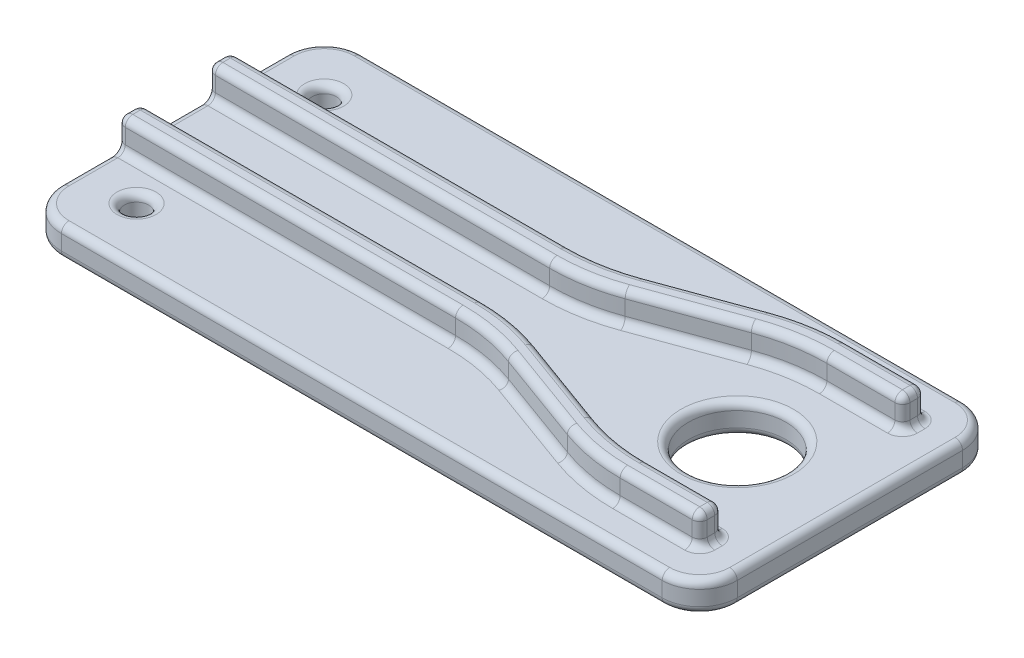
from build123d import *

# Parameters (mm, degrees)
SKETCH1_W           = 90
SKETCH1_H           = 40
SKETCH1_R           = 6.5
SKETCH1_R_2         = 1.6
BOSS_EXTRUDE1_DEPTH = 4
FILLET1_R           = 5
FILLET2_R           = 5
BOSS_EXTRUDE2_DEPTH = 4
FILLET3_R           = 25
FILLET4_R           = 1
FILLET5_R           = 1
FILLET6_R           = 1
FILLET7_R           = 1
FILLET8_R           = 1
FILLET9_R           = 1


with BuildPart() as part:
    # Sketch1 → Boss-Extrude1 (new body)
    with BuildSketch(Plane(origin=(0, 0, 0), x_dir=(1, 0, 0), z_dir=(0, 1, 0))):
        with Locations((45, 20)):
            Rectangle(SKETCH1_W, SKETCH1_H)
        with Locations(Location((75, 20, 0), (0, 0, 270))):
            Circle(SKETCH1_R, mode=Mode.SUBTRACT)
        with Locations(Location((7.5, 32.5, 0), (0, 0, 270))):
            Circle(SKETCH1_R_2, mode=Mode.SUBTRACT)
        with Locations(Location((7.5, 7.5, 0), (0, 0, 270))):
            Circle(SKETCH1_R_2, mode=Mode.SUBTRACT)
    extrude(amount=BOSS_EXTRUDE1_DEPTH)

    # Fillet1
    fillet1_edges = [part.edges().sort_by_distance(p)[0] for p in [
        (0, 2, -40),
        (0, 2, 0),
    ]]
    fillet(fillet1_edges, radius=FILLET1_R)

    # Fillet2
    fillet2_edges = [part.edges().sort_by_distance(p)[0] for p in [
        (90, 2, -40),
        (90, 2, 0),
    ]]
    fillet(fillet2_edges, radius=FILLET2_R)

    # Sketch2 → Boss-Extrude2 (add)
    with BuildSketch(Plane(origin=(0, 4, 0), x_dir=(1, 0, 0), z_dir=(0, 1, 0))):
        Polygon((0, 27.5), (0, 24.5), (49.922900296, 24.5), (70.528980942, 32), (85, 32), (85, 35), (70, 35), (49.393919354, 27.5), align=None)
        Polygon((0, 15.5), (49.922900296, 15.5), (70.528980942, 8), (85, 8), (85, 5), (70, 5), (49.393919354, 12.5), (0, 12.5), align=None)
    extrude(amount=BOSS_EXTRUDE2_DEPTH)

    # Fillet3
    fillet3_edges = [part.edges().sort_by_distance(p)[0] for p in [
        (49.393919354, 6, -27.5),
        (49.922900296, 6, -24.5),
        (70.528980942, 6, -32),
        (70, 6, -35),
        (49.393919354, 6, -12.5),
        (70, 6, -5),
        (70.528980942, 6, -8),
        (49.922900296, 6, -15.5),
    ]]
    fillet(fillet3_edges, radius=FILLET3_R)

    # Fillet4
    fillet4_edges = [part.edges().sort_by_distance(p)[0] for p in [
        (85, 6, -32),
        (85, 6, -35),
        (85, 6, -5),
        (85, 6, -8),
    ]]
    fillet(fillet4_edges, radius=FILLET4_R)

    # Fillet5
    fillet5_edges = [part.edges().sort_by_distance(p)[0] for p in [
        (22.757362889, 4, -15.5),
        (79.204087259, 4, -5),
        (59.696959677, 4, -8.75),
        (49.326949278, 4, -12.120193825),
        (70.595951018, 4, -31.620193825),
        (49.326949278, 4, -27.879806175),
        (70.595951018, 4, -8.379806175),
        (70.066970076, 4, -34.620193825),
        (49.85593022, 4, -15.120193825),
        (49.85593022, 4, -24.879806175),
        (70.066970076, 4, -5.379806175),
        (79.46857773, 4, -8),
        (85, 4, -6.5),
        (79.204087259, 4, -35),
        (85, 4, -33.5),
        (84.707106781, 4, -7.707106781),
        (84.707106781, 4, -5.292893219),
        (84.707106781, 4, -34.707106781),
        (84.707106781, 4, -32.292893219),
        (22.757362889, 4, -24.5),
        (22.492872418, 4, -12.5),
        (60.225940619, 4, -11.75),
        (22.492872418, 4, -27.5),
        (59.696959677, 4, -31.25),
        (79.46857773, 4, -32),
        (60.225940619, 4, -28.25),
    ]]
    fillet(fillet5_edges, radius=FILLET5_R)

    # Fillet6
    fillet6_edges = [part.edges().sort_by_distance(p)[0] for p in [
        (59.696959677, 8, -31.25),
        (22.492872418, 8, -27.5),
        (60.225940619, 8, -28.25),
        (79.46857773, 8, -32),
        (49.85593022, 8, -24.879806175),
        (70.066970076, 8, -34.620193825),
        (22.757362889, 8, -15.5),
        (59.696959677, 8, -8.75),
        (79.204087259, 8, -5),
        (70.066970076, 8, -5.379806175),
        (49.85593022, 8, -15.120193825),
        (70.595951018, 8, -8.379806175),
        (49.326949278, 8, -27.879806175),
        (70.595951018, 8, -31.620193825),
        (49.326949278, 8, -12.120193825),
        (79.46857773, 8, -8),
        (85, 8, -6.5),
        (84.707106781, 8, -5.292893219),
        (84.707106781, 8, -7.707106781),
        (79.204087259, 8, -35),
        (85, 8, -33.5),
        (84.707106781, 8, -32.292893219),
        (84.707106781, 8, -34.707106781),
        (22.757362889, 8, -24.5),
        (22.492872418, 8, -12.5),
        (60.225940619, 8, -11.75),
    ]]
    fillet(fillet6_edges, radius=FILLET6_R)

    # Fillet7
    fillet7_edges = [part.edges().sort_by_distance(p)[0] for p in [
        (0, 0, -20),
        (45, 0, 0),
        (1.464466094, 0, -1.464466094),
        (1.464466094, 0, -38.535533906),
        (90, 0, -20),
        (45, 0, -40),
        (88.535533906, 0, -38.535533906),
        (88.535533906, 0, -1.464466094),
    ]]
    fillet(fillet7_edges, radius=FILLET7_R)

    # Fillet8
    fillet8_edges = [part.edges().sort_by_distance(p)[0] for p in [
        (0, 4, -8.25),
        (0, 4, -20),
        (0, 4.292893219, -27.792893219),
        (0, 4.292893219, -15.792893219),
        (0, 4.292893219, -24.207106781),
        (0, 4.292893219, -12.207106781),
        (0, 8, -14),
        (0, 6, -12.5),
        (0, 6, -15.5),
        (0, 6, -24.5),
        (0, 8, -26),
        (0, 6, -27.5),
        (0, 7.707106781, -24.792893219),
        (0, 4, -31.75),
        (0, 7.707106781, -12.792893219),
        (0, 7.707106781, -27.207106781),
        (0, 7.707106781, -15.207106781),
        (45, 4, 0),
        (1.464466094, 4, -1.464466094),
        (1.464466094, 4, -38.535533906),
        (90, 4, -20),
        (45, 4, -40),
        (88.535533906, 4, -38.535533906),
        (88.535533906, 4, -1.464466094),
    ]]
    fillet(fillet8_edges, radius=FILLET8_R)

    # Fillet9
    fillet9_edges = [part.edges().sort_by_distance(p)[0] for p in [
        (75, 0, -26.5),
        (75, 4, -26.5),
        (7.5, 0, -34.1),
        (7.5, 4, -34.1),
        (7.5, 0, -9.1),
        (7.5, 4, -9.1),
    ]]
    fillet(fillet9_edges, radius=FILLET9_R)


solid = part.part
